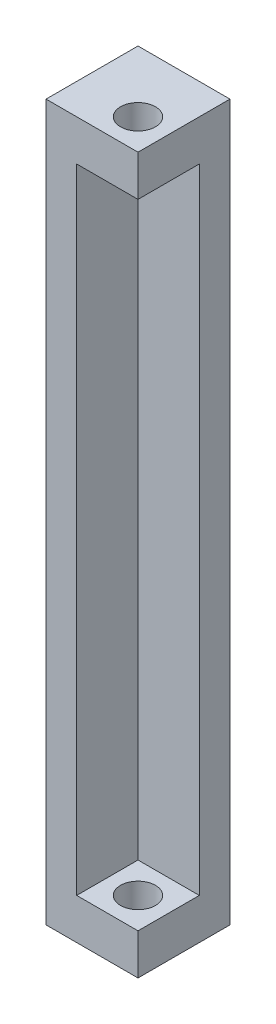
from build123d import *

# Parameters (mm, degrees)
SKETCH2_W           = 11.43
SKETCH2_H           = 11.43
BOSS_EXTRUDE1_DEPTH = 5.08
BOSS_EXTRUDE2_DEPTH = 83.82
SKETCH4_W           = 7.62
SKETCH4_H           = 5.08
BOSS_EXTRUDE3_DEPTH = 7.62
SKETCH5_R           = 2.1717
CUT_EXTRUDE1_DEPTH  = 5.08
SKETCH6_R           = 2.1717
CUT_EXTRUDE2_DEPTH  = 5.08


with BuildPart() as part:
    # Sketch2 → Boss-Extrude1 (new body)
    with BuildSketch(Plane(origin=(0, 0, 0), x_dir=(1, 0, 0), z_dir=(0, 1, 0))):
        with Locations((4.433171137, -5.341620142)):
            Rectangle(SKETCH2_W, SKETCH2_H)
    extrude(amount=BOSS_EXTRUDE1_DEPTH)

    # Sketch3 → Boss-Extrude2 (add)
    with BuildSketch(Plane(origin=(0, 5.08, 0), x_dir=(1, 0, 0), z_dir=(0, 1, 0))):
        Polygon((-1.281828863, -11.056620142), (2.528171137, -11.056620142), (2.528171137, -3.436620142), (10.148171137, -3.436620142), (10.148171137, 0.373379858), (2.528171137, 0.373379858), (-1.281828863, 0.373379858), (-1.281828863, -3.436620142), align=None)
    extrude(amount=BOSS_EXTRUDE2_DEPTH)

    # Sketch4 → Boss-Extrude3 (add)
    with BuildSketch(Plane(origin=(2.528171137, 0, 0), x_dir=(0, 0, -1), z_dir=(1, 0, 0))):
        with Locations((-7.246620142, 86.36)):
            Rectangle(SKETCH4_W, SKETCH4_H)
    extrude(amount=BOSS_EXTRUDE3_DEPTH)

    # Sketch5 → Cut-Extrude1 (cut)
    with BuildSketch(Plane(origin=(0, 88.9, 0), x_dir=(1, 0, 0), z_dir=(0, 1, 0))):
        with Locations(Location((6.338171137, -7.246620142, 0), (0, 0, 270))):
            Circle(SKETCH5_R)
    extrude(amount=-CUT_EXTRUDE1_DEPTH, mode=Mode.SUBTRACT)

    # Sketch6 → Cut-Extrude2 (cut)
    with BuildSketch(Plane(origin=(0, 5.08, 0), x_dir=(1, 0, 0), z_dir=(0, 1, 0))):
        with Locations(Location((6.338171137, -7.246620142, 0), (0, 0, 270))):
            Circle(SKETCH6_R)
    extrude(amount=-CUT_EXTRUDE2_DEPTH, mode=Mode.SUBTRACT)


solid = part.part
